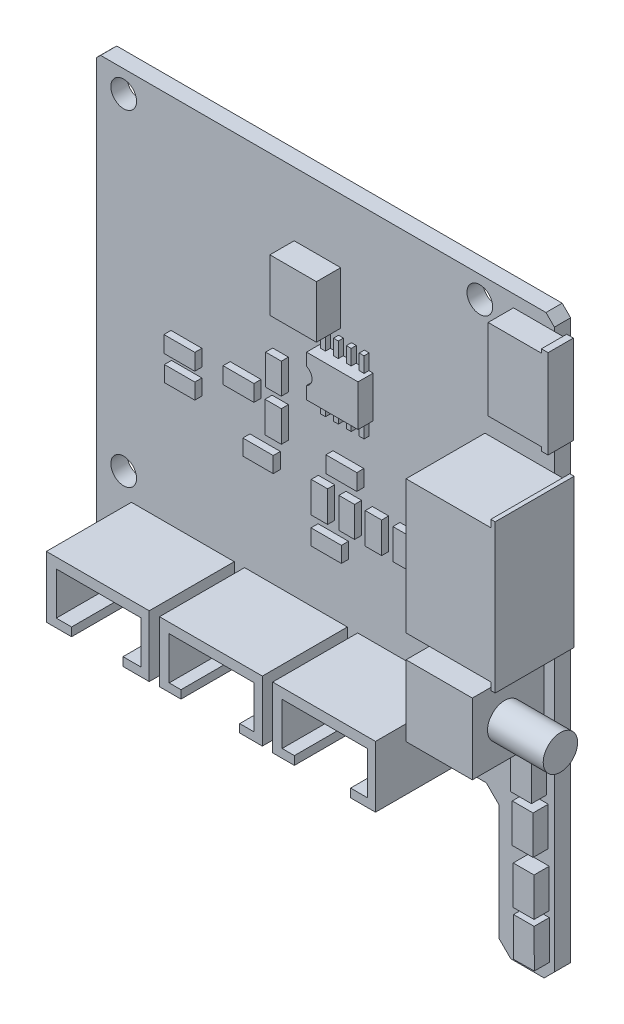
from build123d import *

# Parameters (mm, degrees)
EXTRUDE_1_DEPTH     = 1.6
SKETCH_2_R          = 1.27
CUT_EXTRUDE_1_DEPTH = 10
SKETCH_3_W          = 2.0574
SKETCH_3_H          = 3.81
EXTRUDE_2_DEPTH     = 1.5
SKETCH_5_W          = 6.549898
SKETCH_5_H          = 6.999986
EXTRUDE_3_DEPTH     = 7.1
SKETCH_6_R          = 1.7
EXTRUDE_4_DEPTH     = 5.5
EXTRUDE_5_DEPTH     = 7.8
EXTRUDE_6_DEPTH     = 2.5
EXTRUDE_7_DEPTH     = 1.5
SKETCH_11_W         = 0.48006
SKETCH_11_H         = 1.508252
SKETCH_11_W_2       = 0.461593583
SKETCH_11_W_3       = 0.483221931
SKETCH_11_W_4       = 0.487980392
EXTRUDE_8_DEPTH     = 0.5
SKETCH_12_W         = 10.15873
SKETCH_12_H         = 6.06044
SKETCH_12_H_2       = 5.99186
EXTRUDE_9_DEPTH     = 8.4
SKETCH_13_W         = 8.38258015
SKETCH_13_H         = 4.209278445
SKETCH_13_W_2       = 8.382580151
SKETCH_13_W_3       = 8.418556889
CUT_EXTRUDE_2_DEPTH = 7.4
SKETCH_14_W         = 5.080796954
SKETCH_14_H         = 1.215557976
SKETCH_14_W_2       = 5.799543841
SKETCH_14_H_2       = 0.807842265
SKETCH_14_W_3       = 5.551700087
SKETCH_14_H_3       = 0.876422265
CUT_EXTRUDE_3_DEPTH = 5.4
SKETCH_15_W         = 4.5974
SKETCH_15_H         = 5.1816
EXTRUDE_10_DEPTH    = 2.4
SKETCH_16_W         = 1.5500096
SKETCH_16_H         = 2.999994
SKETCH_16_W_2       = 1.6149574
SKETCH_16_H_2       = 3.0499812
SKETCH_16_W_3       = 3.0499812
SKETCH_16_H_3       = 1.6149828
SKETCH_16_W_4       = 2.999994
SKETCH_16_H_4       = 1.5500096
SKETCH_16_H_5       = 1.6149574
EXTRUDE_11_DEPTH    = 0.7


with BuildPart() as part:
    # 草图1 → 凸台-拉伸1 (new body)
    with BuildSketch(Plane.XY):
        Polygon((21.463, 87.0077), (21.844, 87.376), (65.84188, 87.376), (66.675, 86.54288), (66.675, 31.369), (65.659, 30.353), (62.357, 30.353), (61.214, 31.496), (61.214, 42.926), (59.944, 44.196), (23.114, 44.196), (21.463, 45.847), align=None)
    extrude(amount=EXTRUDE_1_DEPTH)

    # 草图2 → 切除-拉伸1 (cut)
    with BuildSketch(Plane.XY.offset(1.6)):
        with Locations((24.13, 85.217)):
            Circle(SKETCH_2_R)
        with Locations((59.309, 85.217)):
            Circle(SKETCH_2_R)
        with Locations((24.13, 52.959)):
            Circle(SKETCH_2_R)
        with Locations((56.769, 52.959)):
            Circle(SKETCH_2_R)
    extrude(amount=-CUT_EXTRUDE_1_DEPTH, mode=Mode.SUBTRACT)

    # 草图3 → 凸台-拉伸2 (add)
    with BuildSketch(Plane.XY.offset(1.6)):
        Polygon((64.13627, 35.77463), (66.16827, 35.77463), (66.19367, 31.96463), (64.13627, 31.93923), align=None)
        with Locations((64.88303, 48.04537)):
            Rectangle(SKETCH_3_W, SKETCH_3_H)
        with Locations((65.03797, 43.52163)):
            Rectangle(SKETCH_3_W, SKETCH_3_H)
        with Locations((65.13703, 38.26637)):
            Rectangle(SKETCH_3_W, SKETCH_3_H)
    extrude(amount=EXTRUDE_2_DEPTH)

    # 草图5 → 凸台-拉伸3 (add)
    with BuildSketch(Plane.XY.offset(1.6)):
        with Locations((62.393957, 54.356127)):
            Rectangle(SKETCH_5_W, SKETCH_5_H)
    extrude(amount=EXTRUDE_3_DEPTH)

    # 草图6 → 凸台-拉伸4 (add)
    with BuildSketch(Plane(origin=(65.668906, 0, 0), x_dir=(0, 0, -1), z_dir=(1, 0, 0))):
        with Locations((-5.5, 54.356127)):
            Circle(SKETCH_6_R)
    extrude(amount=EXTRUDE_4_DEPTH)

    # 草图7 → 凸台-拉伸5 (add)
    with BuildSketch(Plane.XY.offset(1.6)):
        Polygon((68.1955202, 60.851923), (68.1955202, 60.112529), (68.6255422, 60.112529), (68.6255422, 74.762487), (68.1955202, 74.762487), (68.1955202, 74.042397), (59.819032, 74.042397), (59.819032, 60.851923), align=None)
    extrude(amount=EXTRUDE_5_DEPTH)

    # 草图9 → 凸台-拉伸6 (add)
    with BuildSketch(Plane.XY.offset(1.6)):
        Polygon((62.629288, 78.1685), (67.892077271, 78.1685), (67.892077271, 77.7843442), (68.550028, 77.7843442), (68.550028, 86.54542), (67.892077271, 86.54542), (67.892077271, 86.1695), (62.629288, 86.1695), align=None)
    extrude(amount=EXTRUDE_6_DEPTH)

    # 草图10 → 凸台-拉伸7 (add)
    with BuildSketch(Plane.XY.offset(1.6)):
        with BuildLine():
            Line((43.688, 73.66), (48.777906, 73.66))
            Line((48.777906, 73.66), (48.777906, 69.577966))
            Line((48.777906, 69.577966), (43.688, 69.577966))
            Line((43.688, 69.577966), (43.688, 70.81027666))
            ThreePointArc((43.688, 70.81027666), (44.236587288, 71.628), (43.688, 72.44572334))
            Line((43.688, 72.44572334), (43.688, 73.66))
        make_face()
    extrude(amount=EXTRUDE_7_DEPTH)

    # 草图11 → 凸台-拉伸8 (add)
    with BuildSketch(Plane.XY.offset(1.6)):
        with Locations((44.323, 68.82384)):
            Rectangle(SKETCH_11_W, SKETCH_11_H)
        with Locations((45.602233209, 68.82384)):
            Rectangle(SKETCH_11_W_2, SKETCH_11_H)
        with Locations((46.861419035, 68.82384)):
            Rectangle(SKETCH_11_W_3, SKETCH_11_H)
        with Locations((48.129039804, 68.82384)):
            Rectangle(SKETCH_11_W_4, SKETCH_11_H)
        with Locations((44.323, 74.43216)):
            Rectangle(SKETCH_11_W, SKETCH_11_H)
        with Locations((45.593, 74.43216)):
            Rectangle(SKETCH_11_W, SKETCH_11_H)
        with Locations((46.863, 74.43216)):
            Rectangle(SKETCH_11_W, SKETCH_11_H)
        with Locations((48.133, 74.43216)):
            Rectangle(SKETCH_11_W, SKETCH_11_H)
    extrude(amount=EXTRUDE_8_DEPTH)

    # 草图12 → 凸台-拉伸9 (add)
    with BuildSketch(Plane.XY.offset(1.6)):
        with Locations((29.970984, 47.634779)):
            Rectangle(SKETCH_12_W, SKETCH_12_H)
        with Locations((41.146984, 47.669069)):
            Rectangle(SKETCH_12_W, SKETCH_12_H_2)
        with Locations((52.322984, 47.634779)):
            Rectangle(SKETCH_12_W, SKETCH_12_H)
    extrude(amount=EXTRUDE_9_DEPTH)

    # 草图13 → 切除-拉伸2 (cut)
    with BuildSketch(Plane.XY.offset(10)):
        with Locations((30.06273557, 47.549643749)):
            Rectangle(SKETCH_13_W, SKETCH_13_H)
        with Locations((41.215524612, 47.585620488)):
            Rectangle(SKETCH_13_W_2, SKETCH_13_H)
        with Locations((52.386302023, 47.549643749)):
            Rectangle(SKETCH_13_W_3, SKETCH_13_H)
    extrude(amount=-CUT_EXTRUDE_2_DEPTH, mode=Mode.SUBTRACT)

    # 草图14 → 切除-拉伸3 (cut)
    with BuildSketch(Plane.XY.offset(10)):
        with Locations((29.922285504, 44.837225538)):
            Rectangle(SKETCH_14_W, SKETCH_14_H)
        with Locations((41.087646617, 45.077060133)):
            Rectangle(SKETCH_14_W_2, SKETCH_14_H_2)
        with Locations((52.166262416, 45.042770133)):
            Rectangle(SKETCH_14_W_3, SKETCH_14_H_3)
    extrude(amount=-CUT_EXTRUDE_3_DEPTH, mode=Mode.SUBTRACT)

    # 草图15 → 凸台-拉伸10 (add)
    with BuildSketch(Plane.XY.offset(1.6)):
        with Locations((43.2689, 78.486)):
            Rectangle(SKETCH_15_W, SKETCH_15_H)
    extrude(amount=EXTRUDE_10_DEPTH)

    # 草图16 → 凸台-拉伸11 (add)
    with BuildSketch(Plane.XY.offset(1.6)):
        with Locations((39.624, 69.342)):
            Rectangle(SKETCH_16_W, SKETCH_16_H)
        with Locations((39.5915261, 65.2530064)):
            Rectangle(SKETCH_16_W_2, SKETCH_16_H_2)
        with Locations((36.1700064, 66.7695134)):
            Rectangle(SKETCH_16_W_3, SKETCH_16_H_3)
        with Locations((38.1, 61.595)):
            Rectangle(SKETCH_16_W_4, SKETCH_16_H_4)
        with Locations((44.1635261, 60.6810064)):
            Rectangle(SKETCH_16_W_2, SKETCH_16_H_2)
        with Locations((46.3300064, 64.2295134)):
            Rectangle(SKETCH_16_W_3, SKETCH_16_H_3)
        with Locations((46.863, 60.706)):
            Rectangle(SKETCH_16_W, SKETCH_16_H)
        with Locations((49.4975261, 60.6810064)):
            Rectangle(SKETCH_16_W_2, SKETCH_16_H_2)
        with Locations((52.197, 60.706)):
            Rectangle(SKETCH_16_W, SKETCH_16_H)
        with Locations((44.831, 57.277)):
            Rectangle(SKETCH_16_W_4, SKETCH_16_H_4)
        with Locations((56.769, 56.007)):
            Rectangle(SKETCH_16_W_4, SKETCH_16_H_4)
        with Locations((30.3280064, 66.5155261)):
            Rectangle(SKETCH_16_W_3, SKETCH_16_H_5)
        with Locations((30.353, 64.008)):
            Rectangle(SKETCH_16_W_4, SKETCH_16_H_4)
    extrude(amount=EXTRUDE_11_DEPTH)


solid = part.part
